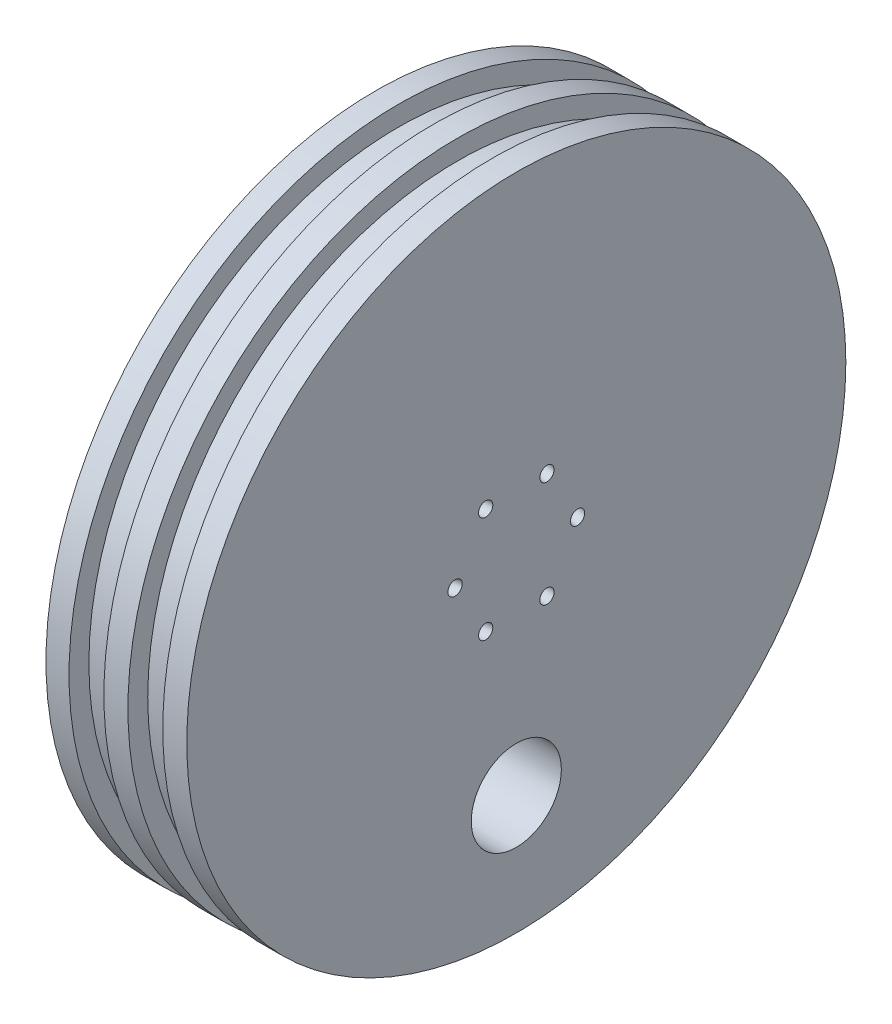
from build123d import *

# Parameters (mm, degrees)
CIRPATTERN2_COUNT                = 3
CIRPATTERN1_COUNT                = 6
F_8_32_TAPPED_HOLE1_D            = 3.4544
F_8_32_TAPPED_HOLE1_DEPTH        = 6.35
F_8_32_TAPPED_HOLE1_TIP          = 1.037806461
F_50_0_07_DIAMETER_HOLE1_D       = 1.778
F_50_0_07_DIAMETER_HOLE1_DEPTH   = 11.938
F_50_0_07_DIAMETER_HOLE1_TIP     = 0.53416509
Q_0_332_DIAMETER_HOLE1_D         = 8.4328
F_3_8_0_375_DIAMETER_HOLE1_D     = 9.525
F_3_8_0_375_DIAMETER_HOLE1_DEPTH = 9.144
F_3_8_0_375_DIAMETER_HOLE1_TIP   = 2.861598698


with BuildPart() as part:
    # Sketch1 → Revolve1 (revolve)
    with BuildSketch(Plane.XY):
        Polygon((-12.599, 0), (0, 0), (0, 34.8361), (-2.54, 34.8361), (-2.54, 32.7406), (-6.223, 32.7406), (-6.223, 34.8361), (-8.763, 34.8361), (-8.763, 32.7406), (-12.446, 32.7406), (-12.446, 34.8361), (-14.885, 34.8361), (-14.885, 29.1592), (-18.06, 29.1592), (-18.06, 4.7625), (-12.599, 4.7625), align=None)
    revolve(axis=Axis((17.779879847, 0, 0), (-1, 0, 0)))

    # Sketch24 → #20 (0.161) Diameter Hole1 (revolve, cut)
    with BuildSketch(Plane(origin=(-18.06, 22.225, 0), x_dir=(0, 0, 1), z_dir=(0, 1, 0))):
        Polygon((0, 0), (0, 10.880579708), (2.0447, 9.652), (2.0447, 0), align=None)
    f_20_0_161_diameter_hole1 = revolve(axis=Axis((-24.41, 22.225, 0), (1, 0, 0)), mode=Mode.SUBTRACT)

    # CirPattern2: #20 (0.161) Diameter Hole1 ×3 about axis
    cirpattern2_axis = Axis((17.779879847, 0, 0), (1, 0, 0))
    for i in range(1, CIRPATTERN2_COUNT):
        add(f_20_0_161_diameter_hole1.rotate(cirpattern2_axis, i * 360 / CIRPATTERN2_COUNT), mode=Mode.SUBTRACT)

    # Sketch19 → Ø1.5 (1.5) Diameter Hole4 (revolve, cut)
    with BuildSketch(Plane(origin=(0.866676253, -0.068634017, -6.358122396), x_dir=(0.15097729062415485, 0.7033639629103843, -0.6946113973977026), z_dir=(-0.040958510327058266, 0.7065134112073841, 0.7065134112073841))):
        Polygon((0, 0), (0, 24.51962842), (0.75, 24.068982956), (0.75, 0), align=None)
    f_1_5_1_5_diameter_hole4 = revolve(axis=Axis((7.138497216, -0.565313443, -5.497848394), (-0.9876883405951382, 0.07821723252011407, -0.13547622075226584)), mode=Mode.SUBTRACT)

    # CirPattern1: Ø1.5 (1.5) Diameter Hole4 ×6 about axis
    cirpattern1_axis = Axis((-26.67, 0, 0), (1, 0, 0))
    for i in range(1, CIRPATTERN1_COUNT):
        add(f_1_5_1_5_diameter_hole4.rotate(cirpattern1_axis, i * 360 / CIRPATTERN1_COUNT), mode=Mode.SUBTRACT)

    # #8-32 Tapped Hole1
    with Locations(Plane.ZY.offset(12.599)):
        with Locations((0, 0)):
            Hole(F_8_32_TAPPED_HOLE1_D / 2, depth=F_8_32_TAPPED_HOLE1_DEPTH)
            with Locations((0, 0, -(F_8_32_TAPPED_HOLE1_DEPTH + F_8_32_TAPPED_HOLE1_TIP / 2))):  # 118° drill point
                Cone(0, F_8_32_TAPPED_HOLE1_D / 2, F_8_32_TAPPED_HOLE1_TIP, mode=Mode.SUBTRACT)

    # #50 (0.07) Diameter Hole1
    with Locations(Plane.ZY.offset(18.06)):
        with Locations((19.632362891, 11.33475)):
            Hole(F_50_0_07_DIAMETER_HOLE1_D / 2, depth=F_50_0_07_DIAMETER_HOLE1_DEPTH)
            with Locations((0, 0, -(F_50_0_07_DIAMETER_HOLE1_DEPTH + F_50_0_07_DIAMETER_HOLE1_TIP / 2))):  # 118° drill point
                Cone(0, F_50_0_07_DIAMETER_HOLE1_D / 2, F_50_0_07_DIAMETER_HOLE1_TIP, mode=Mode.SUBTRACT)

    # Q (0.332) Diameter Hole1 (through all)
    with Locations(Plane.ZY.offset(18.06)):
        with Locations((0, -22.225)):
            Hole(Q_0_332_DIAMETER_HOLE1_D / 2)

    # 3/8 (0.375) Diameter Hole1
    with Locations(Plane(origin=(0, 0, 0), x_dir=(0, 0, -1), z_dir=(1, 0, 0))):
        with Locations((0, -22.225)):
            Hole(F_3_8_0_375_DIAMETER_HOLE1_D / 2, depth=F_3_8_0_375_DIAMETER_HOLE1_DEPTH)
            with Locations((0, 0, -(F_3_8_0_375_DIAMETER_HOLE1_DEPTH + F_3_8_0_375_DIAMETER_HOLE1_TIP / 2))):  # 118° drill point
                Cone(0, F_3_8_0_375_DIAMETER_HOLE1_D / 2, F_3_8_0_375_DIAMETER_HOLE1_TIP, mode=Mode.SUBTRACT)


solid = part.part
